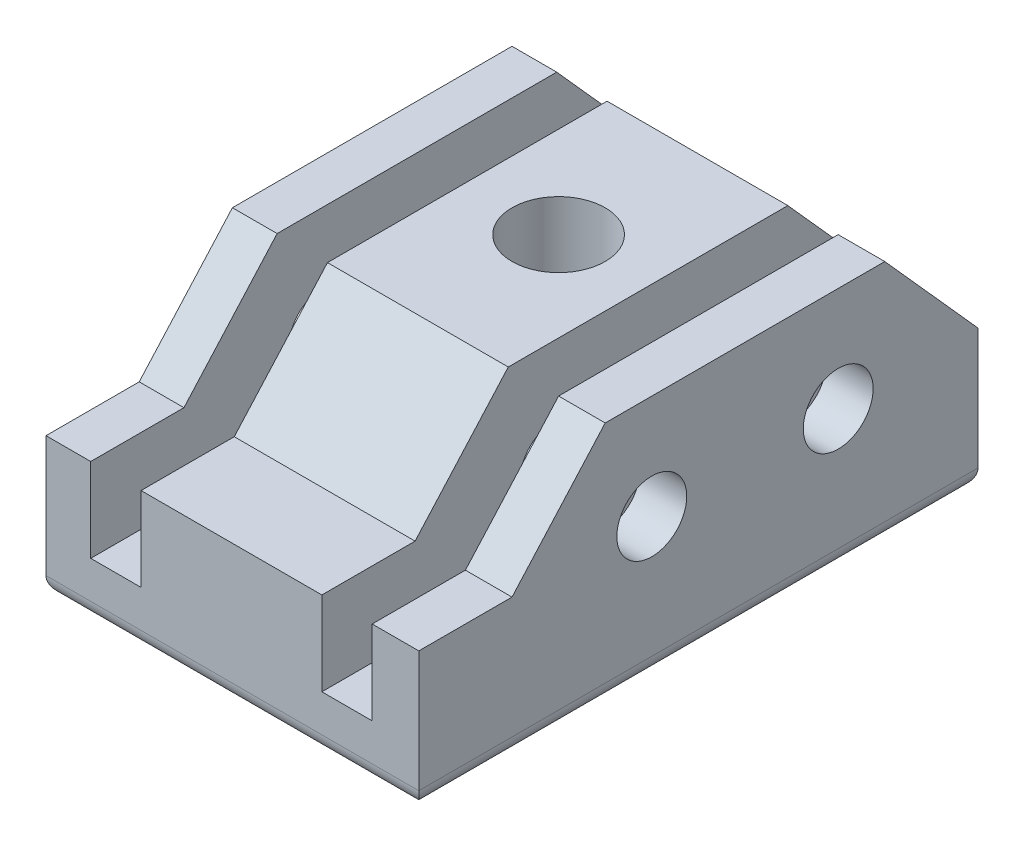
from build123d import *

# Parameters (mm, degrees)
SKETCH1_W           = 63.5
SKETCH1_H           = 6.35
BOSS_EXTRUDE1_DEPTH = 50.8
BOSS_EXTRUDE2_DEPTH = 50.8
SKETCH10_W          = 6.858
SKETCH10_H          = 25.629031657
CUT_EXTRUDE1_DEPTH  = 88.854357354
LPATTERN3_COUNT     = 2
LPATTERN3_PITCH     = 31.496
SKETCH11_R          = 4.7625
CUT_EXTRUDE2_DEPTH  = 88.854357354
BOSS_EXTRUDE3_DEPTH = 12.7
SKETCH23_R          = 6.35
CUT_EXTRUDE6_DEPTH  = 88.854357354
FILLET2_R           = 2.54
SKETCH24_R          = 3.05
CUT_EXTRUDE7_DEPTH  = 10


with BuildPart() as part:
    # Sketch1 → Boss-Extrude1 (new body)
    with BuildSketch(Plane(origin=(0, 0, 0), x_dir=(0, 0, -1), z_dir=(1, 0, 0))):
        with Locations((31.75, 3.175)):
            Rectangle(SKETCH1_W, SKETCH1_H)
    extrude(amount=-BOSS_EXTRUDE1_DEPTH)

    # Sketch2 → Boss-Extrude2 (add)
    with BuildSketch(Plane(origin=(0, 0, 0), x_dir=(0, 0, -1), z_dir=(1, 0, 0))):
        Polygon((0, 6.35), (0, 19.05), (12.7, 33.249031657), (50.8, 33.249031657), (63.5, 19.05), (63.5, 6.35), align=None)
    extrude(amount=-BOSS_EXTRUDE2_DEPTH)

    # Sketch10 → Cut-Extrude1 (cut, through all)
    with BuildSketch(Plane(origin=(0, 0, -63.5), x_dir=(-1, 0, 0), z_dir=(0, 0, -1))):
        with Locations((9.779, 20.434515829)):
            Rectangle(SKETCH10_W, SKETCH10_H)
    cut_extrude1 = extrude(amount=-CUT_EXTRUDE1_DEPTH, mode=Mode.SUBTRACT)

    # LPattern3: Cut-Extrude1 ×2
    with Locations(*[(-i * LPATTERN3_PITCH, 0, 0) for i in range(1, LPATTERN3_COUNT)]):
        add(cut_extrude1, mode=Mode.SUBTRACT)

    # Sketch11 → Cut-Extrude2 (cut, through all)
    with BuildSketch(Plane(origin=(0, 0, 0), x_dir=(0, 0, -1), z_dir=(1, 0, 0))):
        with Locations((19.05, 19.05)):
            Circle(SKETCH11_R)
        with Locations((44.45, 19.05)):
            Circle(SKETCH11_R)
    extrude(amount=-CUT_EXTRUDE2_DEPTH, mode=Mode.SUBTRACT)

    # Sketch22 → Boss-Extrude3 (add)
    with BuildSketch(Plane.XY):
        Polygon((0, 0), (-50.8, 0), (-50.8, 7.62), (-50.8, 19.05), (-44.704, 19.05), (-44.704, 7.62), (-37.846, 7.62), (-37.846, 19.05), (-13.208, 19.05), (-13.208, 7.62), (-6.35, 7.62), (-6.35, 19.05), (0, 19.05), (0, 7.62), align=None)
    extrude(amount=BOSS_EXTRUDE3_DEPTH)

    # Sketch23 → Cut-Extrude6 (cut, through all)
    with BuildSketch(Plane(origin=(0, 33.249031657, 0), x_dir=(1, 0, 0), z_dir=(0, 1, 0))):
        with Locations(Location((-25.4, 31.75, 0), (0, 0, 270))):
            Circle(SKETCH23_R)
    extrude(amount=-CUT_EXTRUDE6_DEPTH, mode=Mode.SUBTRACT)

    # Fillet2
    fillet2_edges = [part.edges().sort_by_distance(p)[0] for p in [
        (-25.4, 0, 12.7),
        (0, 0, -25.4),
        (-50.8, 0, -25.4),
        (-25.4, 0, -63.5),
    ]]
    fillet(fillet2_edges, radius=FILLET2_R)

    # Sketch24 → Cut-Extrude7 (cut)
    with BuildSketch(Plane.XZ):
        with Locations(Location((-30.4, -46.15, 0), (0, 0, 270))):
            Circle(SKETCH24_R)
        with Locations(Location((-20.4, -46.15, 0), (0, 0, 270))):
            Circle(SKETCH24_R)
        with Locations(Location((-20.4, 3.35, 0), (0, 0, 270))):
            Circle(SKETCH24_R)
        with Locations(Location((-30.4, 3.35, 0), (0, 0, 270))):
            Circle(SKETCH24_R)
    extrude(amount=-CUT_EXTRUDE7_DEPTH, mode=Mode.SUBTRACT)


solid = part.part
